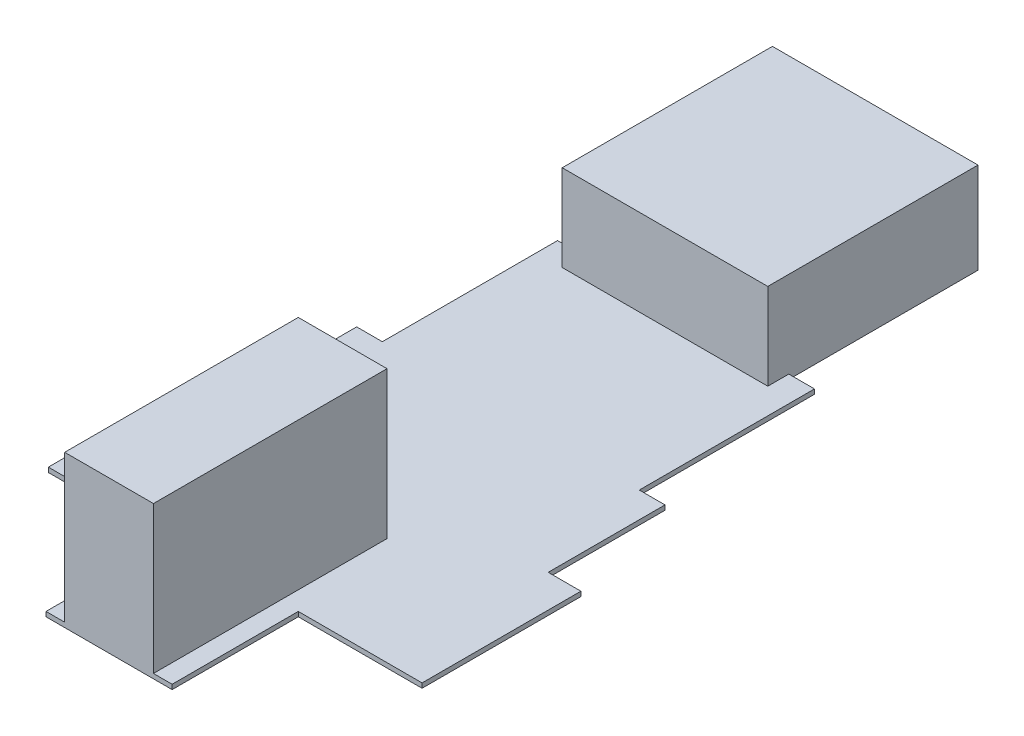
from build123d import *

# Parameters (mm, degrees)
BOSS_EXTRUDE1_DEPTH      = 2
BOSS_EXTRUDE2_DEPTH      = 19
BOSS_EXTRUDE2_DEPTH_BACK = 19
SKETCH3_W                = 100
SKETCH3_H                = 63
BOSS_EXTRUDE3_START      = -44
SKETCH6_W                = 90
SKETCH6_H                = 37
BOSS_EXTRUDE3_DEPTH      = 88


with BuildPart() as part:
    # Sketch2 → Boss-Extrude1 (new body)
    with BuildSketch(Plane(origin=(0, 0, 0), x_dir=(1, 0, 0), z_dir=(0, 1, 0))):
        Polygon((-27, 0), (27, 0), (27, 54), (80, 54), (80, 122), (66, 122), (66, 172), (55, 172), (55, 247), (44, 247), (44, 328), (-44, 328), (-44, 247), (-55, 247), (-55, 172), (-66, 172), (-66, 122), (-80, 122), (-80, 54), (-27, 54), align=None)
    extrude(amount=BOSS_EXTRUDE1_DEPTH)

    # Sketch3 → Boss-Extrude2 (add, two sides: drawn at the far end of the back side and taken through both)
    with BuildSketch(Plane(origin=(0, 0, 0), x_dir=(0, 0, -1), z_dir=(1, 0, 0)).offset(-BOSS_EXTRUDE2_DEPTH_BACK)):
        with Locations((50, 33.5)):
            Rectangle(SKETCH3_W, SKETCH3_H)
    extrude(amount=BOSS_EXTRUDE2_DEPTH + BOSS_EXTRUDE2_DEPTH_BACK)

    # Sketch6 → Boss-Extrude3 (add)
    with BuildSketch(Plane(origin=(0, 0, 0), x_dir=(0, 0, -1), z_dir=(1, 0, 0)).offset(BOSS_EXTRUDE3_START)):
        with Locations((283, 20.5)):
            Rectangle(SKETCH6_W, SKETCH6_H)
    extrude(amount=BOSS_EXTRUDE3_DEPTH)


solid = part.part
